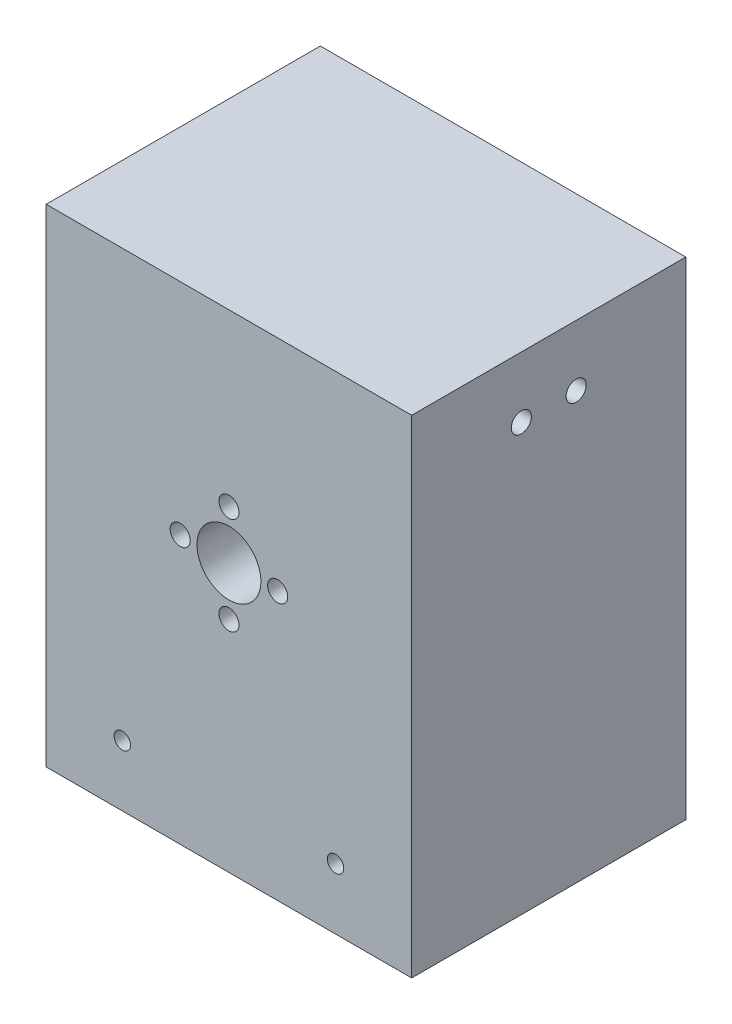
from build123d import *

# Parameters (mm, degrees)
SKETCH_1_W          = 60
SKETCH_1_H          = 80
EXTRUDE_1_DEPTH     = 45
SKETCH_2_R          = 1.35
CUT_EXTRUDE_1_DEPTH = 100
SKETCH_3_R          = 1.65
CUT_EXTRUDE_2_DEPTH = 100
SKETCH_4_R          = 5.25
CUT_EXTRUDE_3_DEPTH = 1000
SKETCH_5_W          = 48
SKETCH_5_H          = 33
CUT_EXTRUDE_4_DEPTH = 25
SKETCH_6_R          = 1.65
CUT_EXTRUDE_5_DEPTH = 5000


with BuildPart() as part:
    # 草图1 → 凸台-拉伸1 (new body)
    with BuildSketch(Plane.XY):
        Rectangle(SKETCH_1_W, SKETCH_1_H)
    extrude(amount=EXTRUDE_1_DEPTH)

    # 草图2 → 切除-拉伸1 (cut)
    with BuildSketch(Plane.XY.offset(45)):
        with Locations((17.5, -30)):
            Circle(SKETCH_2_R)
        with Locations((-17.5, -30)):
            Circle(SKETCH_2_R)
    extrude(amount=-CUT_EXTRUDE_1_DEPTH, mode=Mode.SUBTRACT)

    # 草图3 → 切除-拉伸2 (cut)
    with BuildSketch(Plane.XY.offset(45)):
        with Locations((8, 4)):
            Circle(SKETCH_3_R)
        with Locations((0, 12)):
            Circle(SKETCH_3_R)
        with Locations((-8, 4)):
            Circle(SKETCH_3_R)
        with Locations((0, -4)):
            Circle(SKETCH_3_R)
    extrude(amount=-CUT_EXTRUDE_2_DEPTH, mode=Mode.SUBTRACT)

    # 草图4 → 切除-拉伸3 (cut)
    with BuildSketch(Plane.XY.offset(45)):
        with Locations((0, 4)):
            Circle(SKETCH_4_R)
    extrude(amount=-CUT_EXTRUDE_3_DEPTH, mode=Mode.SUBTRACT)

    # 草图5 → 切除-拉伸4 (cut)
    with BuildSketch(Plane.XZ.offset(40)):
        with Locations((0, 22.5)):
            Rectangle(SKETCH_5_W, SKETCH_5_H)
    extrude(amount=-CUT_EXTRUDE_4_DEPTH, mode=Mode.SUBTRACT)

    # 草图6 → 切除-拉伸5 (cut)
    with BuildSketch(Plane(origin=(30, 0, 0), x_dir=(0, 0, -1), z_dir=(1, 0, 0))):
        with Locations((-18, 30)):
            Circle(SKETCH_6_R)
        with Locations((-27, 30)):
            Circle(SKETCH_6_R)
    extrude(amount=-CUT_EXTRUDE_5_DEPTH, mode=Mode.SUBTRACT)


solid = part.part
